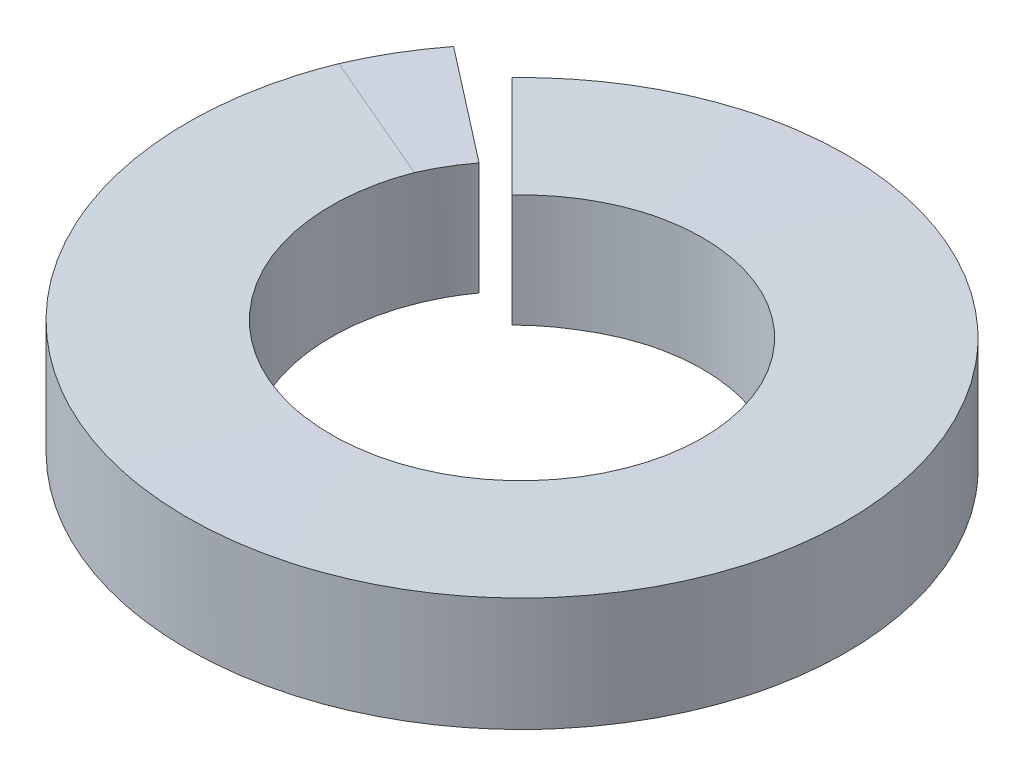
from build123d import *

# Parameters (mm, degrees)
SWEEP1_PITCH            = 0.255102041
SWEEP1_HEIGHT           = 0.25
SWEEP1_RADIUS           = 2.15
SWEEP1_START_ANGLE      = -135
SKETCH1_W               = 1.2
SKETCH1_H               = 0.95
CUT_EXTRUDE1_DEPTH      = 10
CUT_EXTRUDE1_DEPTH_BACK = 10
SKETCH3_OUTSIDE_W       = 9.074
SKETCH3_OUTSIDE_H       = 4.774
SKETCH3_OUTSIDE_W_2     = 6.103736904
SKETCH3_OUTSIDE_H_2     = 1.18


with BuildPart() as part:
    # Sweep1: sweep along a helix
    with BuildLine() as sweep1_path:
        add(Helix(SWEEP1_PITCH, SWEEP1_HEIGHT, SWEEP1_RADIUS, center=(0, 0, 0), direction=(0, 1, 0), lefthand=True, mode=Mode.PRIVATE).rotate(Axis((0, 0, 0), (0, 1, 0)), SWEEP1_START_ANGLE))
    # Sketch1 → Sweep1 (sweep)
    with BuildSketch(Plane.XY):
        with Locations((2.15, 0)):
            Rectangle(SKETCH1_W, SKETCH1_H)
    sweep(path=sweep1_path.line, is_frenet=True)

    # Sketch3 outside → Cut-Extrude1 (cut, two sides: drawn at the far end of the back side and taken through both)
    with BuildSketch(Plane.XY.offset(-CUT_EXTRUDE1_DEPTH_BACK)):
        with Locations((0, 0.029)):
            Rectangle(SKETCH3_OUTSIDE_W, SKETCH3_OUTSIDE_H)
        with Locations((0, 0.029337102)):
            Rectangle(SKETCH3_OUTSIDE_W_2, SKETCH3_OUTSIDE_H_2, mode=Mode.SUBTRACT)
    extrude(amount=CUT_EXTRUDE1_DEPTH + CUT_EXTRUDE1_DEPTH_BACK, mode=Mode.SUBTRACT)


solid = part.part
